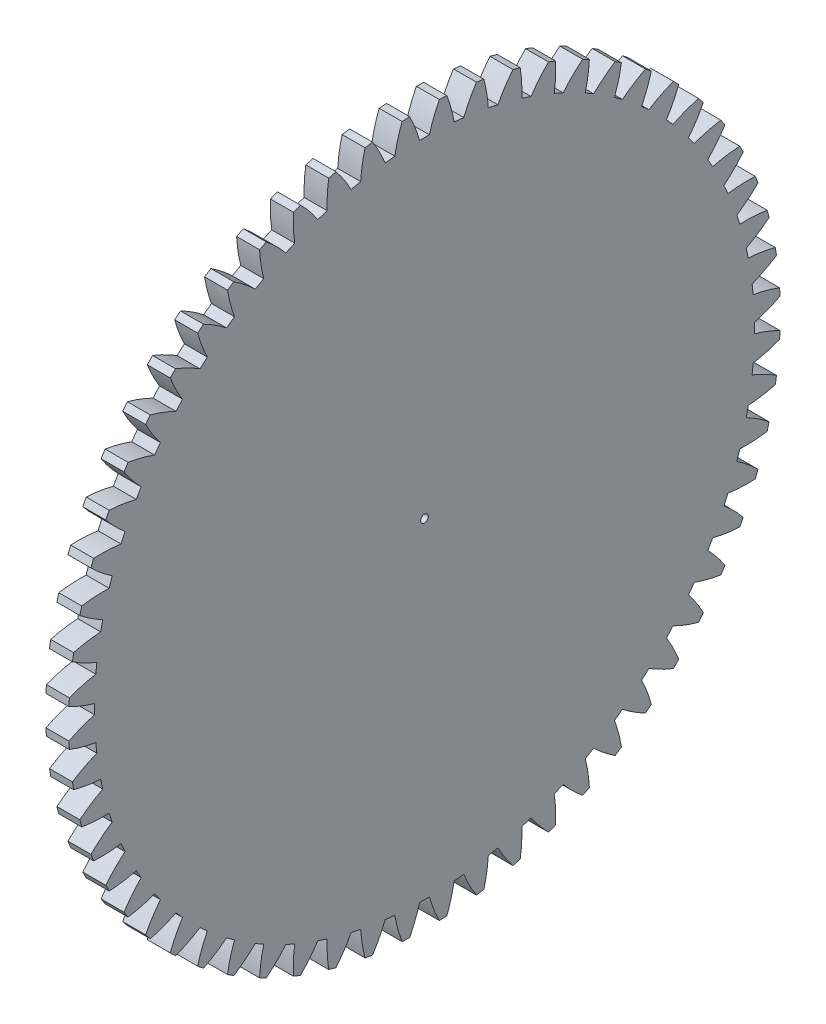
from build123d import *

# Parameters (mm, degrees)
BASPROSKE_W     = 3
BASPROSKE_H     = 46.5
TOOTHCUT_DEPTH  = 66.829324772
TEETHCUTS_COUNT = 60
TEETHCUTS_ANGLE = 354
BORSKE_R        = 0.5
BORE_DEPTH      = 50.0000508


with BuildPart() as part:
    # BasProSke → Base-Revolve (revolve)
    with BuildSketch(Plane(origin=(0, 0, 0), x_dir=(1, 0, 0), z_dir=(0, 1, 0)), mode=Mode.PRIVATE) as base_revolve_sk:
        with Locations((1.5, 23.25)):
            Rectangle(BASPROSKE_W, BASPROSKE_H)
    revolve(base_revolve_sk.sketch.rotate(Axis((-10, 0, 0), (1, 0, 0)), 180), axis=Axis((-10, 0, 0), (1, 0, 0)))

    # TooCutSke → ToothCut (cut, through all)
    with BuildSketch(Plane(origin=(0, 0, 0), x_dir=(0, 0, -1), z_dir=(1, 0, 0))):
        with BuildLine():
            ThreePointArc((0.638657789, 43.119270544), (0, 43.124), (-0.638657789, 43.119270544))
            ThreePointArc((-0.638657789, 43.119270544), (-1.21237986, 44.83490593), (-1.955410143, 46.484289995))
            ThreePointArc((-1.955410143, 46.484289995), (0, 46.5254), (1.955410143, 46.484289995))
            ThreePointArc((1.955410143, 46.484289995), (1.21237986, 44.83490593), (0.638657789, 43.119270544))
        make_face()
    toothcut = extrude(amount=TOOTHCUT_DEPTH, mode=Mode.SUBTRACT)

    # TeethCuts: ToothCut ×60 about axis
    teethcuts_axis = Axis((-10, 0, 0), (1, 0, 0))
    for i in range(1, TEETHCUTS_COUNT):
        add(toothcut.rotate(teethcuts_axis, i * TEETHCUTS_ANGLE / (TEETHCUTS_COUNT - 1)), mode=Mode.SUBTRACT)

    # BorSke → Bore (cut, symmetric)
    with BuildSketch(Plane(origin=(0, 0, 0), x_dir=(0, 0, -1), z_dir=(1, 0, 0))):
        with Locations(Location((0, 0, 0), (0, 0, 180))):
            Circle(BORSKE_R)
    extrude(amount=BORE_DEPTH, both=True, mode=Mode.SUBTRACT)


solid = part.part
